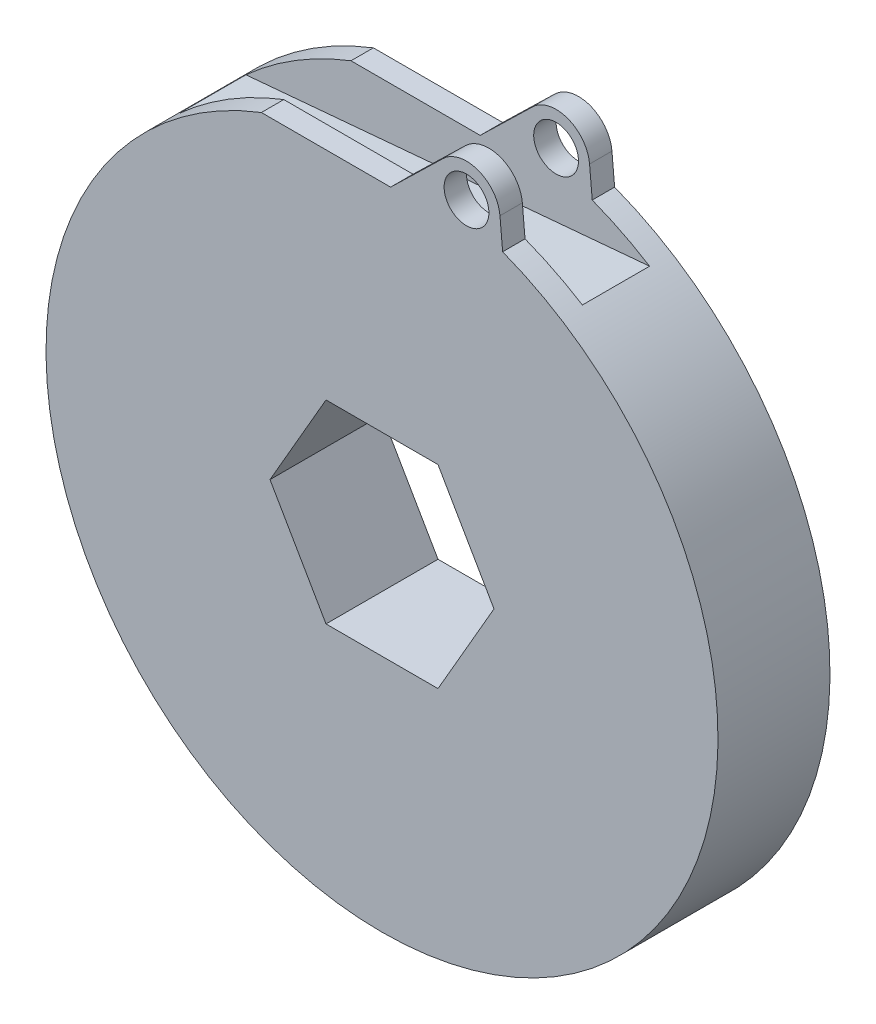
from build123d import *

# Parameters (mm, degrees)
SKETCH_1_R               = 15
EXTRUDE_1_DEPTH          = 5
CUT_EXTRUDE_1_DEPTH      = 30
CUT_EXTRUDE_2_DEPTH      = 60
SKETCH_4_R               = 1
EXTRUDE_2_DEPTH          = 5
SKETCH_5_W               = 3
SKETCH_5_H               = 5.040496026
CUT_EXTRUDE_3_DEPTH      = 28.39432933
CUT_EXTRUDE_4_DEPTH      = 28.39432933
CUT_EXTRUDE_4_DEPTH_BACK = 28.39432933
SKETCH_6_W               = 3
SKETCH_6_H               = 1.5


with BuildPart() as part:
    # 草图1 → 凸台-拉伸1 (new body)
    with BuildSketch(Plane.XY):
        Circle(SKETCH_1_R)
    extrude(amount=EXTRUDE_1_DEPTH)

    # 草图2 → 切除-拉伸1 (cut)
    with BuildSketch(Plane.XY.offset(5)):
        Polygon((-2.5, -4.330127019), (2.5, -4.330127019), (5, 0), (2.5, 4.330127019), (-2.5, 4.330127019), (-5, 0), align=None)
    extrude(amount=-CUT_EXTRUDE_1_DEPTH, mode=Mode.SUBTRACT)

    # 草图3 → 切除-拉伸2 (cut)
    with BuildSketch(Plane.XY.offset(5)):
        Polygon((-8.586571111, 14), (9.123789919, 14), (-0.951474436, 18.675160858), align=None)
    extrude(amount=-CUT_EXTRUDE_2_DEPTH, mode=Mode.SUBTRACT)

    # 草图4 → 凸台-拉伸2 (add)
    with BuildSketch(Plane.XY.offset(5)):
        with BuildLine():
            Line((5.385164807, 14), (5.26595559, 15.333555474))
            ThreePointArc((5.26595559, 15.333555474), (4.293622117, 16.606349783), (2.726438877, 16.275631735))
            Line((2.726438877, 16.275631735), (0.385164807, 14))
            Line((0.385164807, 14), (5.385164807, 14))
        make_face()
        with Locations((3.771913109, 15.2)):
            Circle(SKETCH_4_R, mode=Mode.SUBTRACT)
    extrude(amount=-EXTRUDE_2_DEPTH)

    # 草图5 → 切除-拉伸3 (cut, through all)
    with BuildSketch(Plane(origin=(6.584040452, 0.588560672, 0), x_dir=(0, 0, -1), z_dir=(0.996028320712149, 0.08903698298648982, 0))):
        with Locations((-2.5, 15.985165676)):
            Rectangle(SKETCH_5_W, SKETCH_5_H)
    extrude(amount=-CUT_EXTRUDE_3_DEPTH, mode=Mode.SUBTRACT)

    # 草图6 → 切除-拉伸4 (cut, two sides: drawn at the far end of the back side and taken through both)
    with BuildSketch(Plane(origin=(6.584040452, 0.588560672, 0), x_dir=(0, 0, -1), z_dir=(0.996028320712149, 0.08903698298649015, 0)).offset(-CUT_EXTRUDE_4_DEPTH_BACK)):
        with Locations((-2.5, 12.714917663)):
            Rectangle(SKETCH_6_W, SKETCH_6_H)
    extrude(amount=CUT_EXTRUDE_4_DEPTH + CUT_EXTRUDE_4_DEPTH_BACK, mode=Mode.SUBTRACT)


solid = part.part
